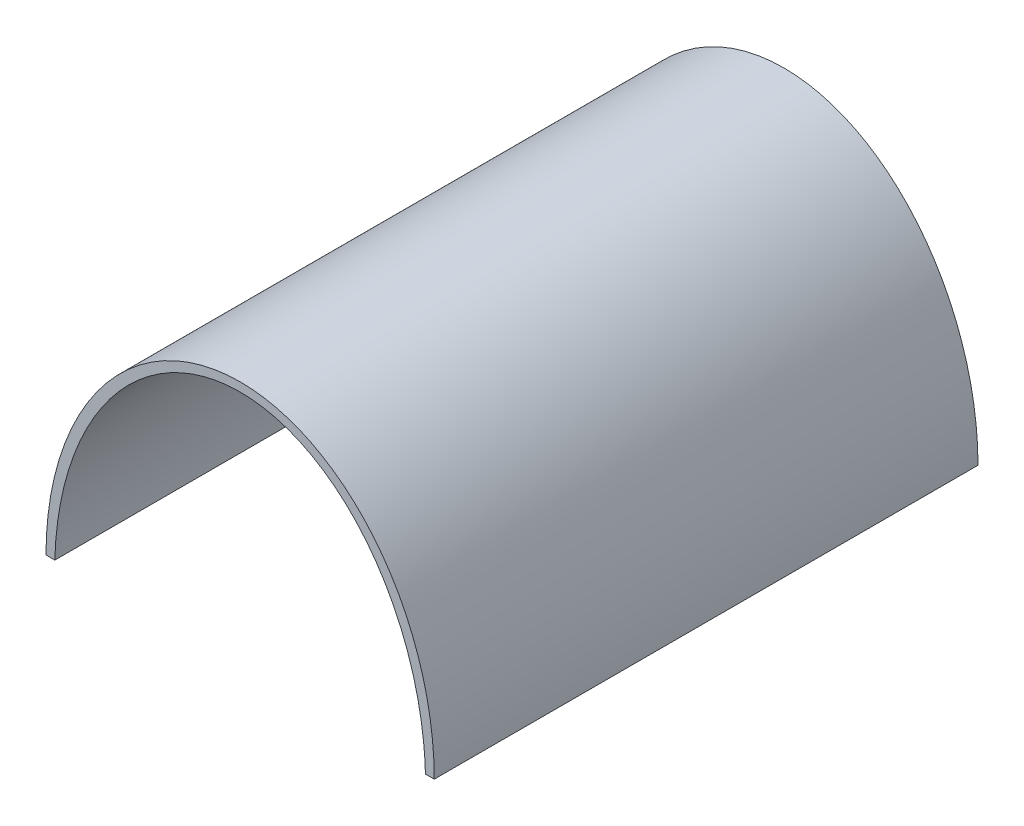
from build123d import *

# Parameters (mm, degrees)
BOSS_EXTRUDE2_DEPTH      = 990.6
BOSS_EXTRUDE2_DEPTH_BACK = 183.255948


with BuildPart() as part:
    # Sketch1 → Boss-Extrude2 (new, two sides: drawn at the far end of the back side and taken through both)
    with BuildSketch(Plane.XY.offset(-BOSS_EXTRUDE2_DEPTH_BACK)):
        with BuildLine():
            Line((-419.1, 0), (-400.05, 0))
            add(Edge.make_bspline(
                [(400.05, 0), (386.255172414, 514.35), (0, 514.35), (-386.255172414, 514.35), (-400.05, 0)],
                knots=[1.606518209, 1.606518209, 1.606518209, 3.141592654, 3.141592654, 4.676667098, 4.676667098, 4.676667098], degree=2, weights=[1, 0.719622917, 1, 0.719622917, 1]))
            Line((400.05, 0), (419.1, 0))
            add(Edge.make_bspline(
                [(419.1, 0), (419.1, 533.4), (0, 533.4), (-419.1, 533.4), (-419.1, 0)],
                knots=[1.570796327, 1.570796327, 1.570796327, 3.141592654, 3.141592654, 4.71238898, 4.71238898, 4.71238898], degree=2, weights=[1, 0.707106781, 1, 0.707106781, 1]))
        make_face()
    extrude(amount=BOSS_EXTRUDE2_DEPTH + BOSS_EXTRUDE2_DEPTH_BACK)


solid = part.part
